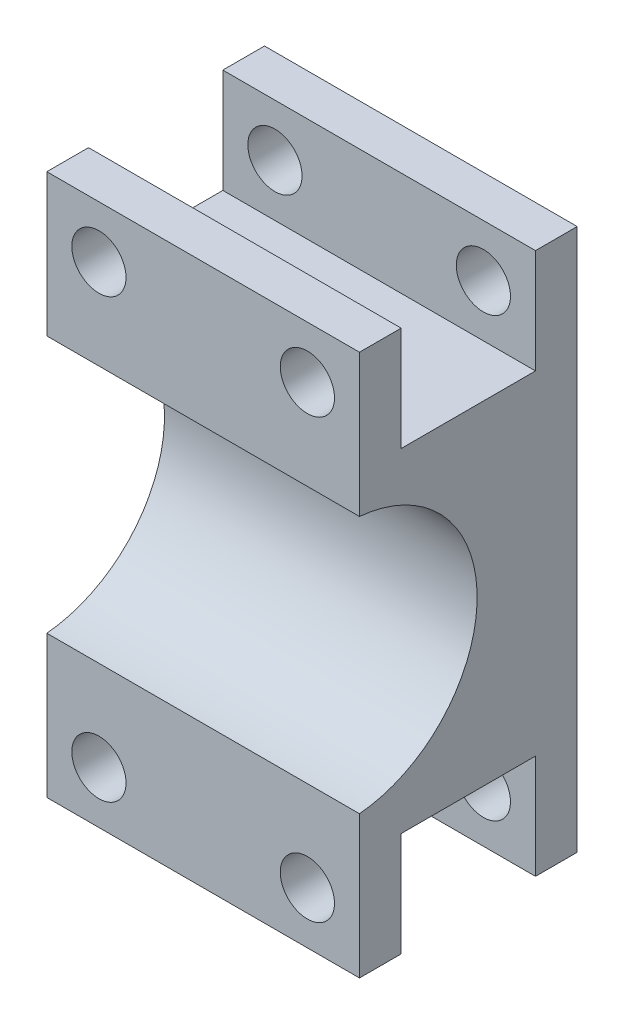
from build123d import *

# Parameters (mm, degrees)
SKETCH_1_W          = 30
SKETCH_1_H          = 32
EXTRUDE_1_DEPTH     = 7
EXTRUDE_2_DEPTH     = 30
SKETCH_3_R          = 2.6
EXTRUDE_3_DEPTH     = 4
SKETCH_4_W          = 30
SKETCH_4_H          = 4
EXTRUDE_5_DEPTH     = 10
SKETCH_5_W          = 30
SKETCH_5_H          = 4
EXTRUDE_6_DEPTH     = 10
CUT_EXTRUDE_START   = -10
SKETCH_6_R          = 2.6
CUT_EXTRUDE_1_DEPTH = 10


with BuildPart() as part:
    # Эскиз1 → Бобышка-Вытянуть1 (new body)
    with BuildSketch(Plane.XY):
        with Locations((15, 16)):
            Rectangle(SKETCH_1_W, SKETCH_1_H)
    extrude(amount=EXTRUDE_1_DEPTH)

    # Эскиз2 → Бобышка-Вытянуть2 (add)
    with BuildSketch(Plane.ZY):
        with BuildLine():
            Line((7, 32), (20.887570227, 32))
            Line((20.887570227, 32), (20.887570227, 28.35))
            ThreePointArc((20.887570227, 28.35), (9.6, 16), (20.887570227, 3.65))
            Line((20.887570227, 3.65), (20.887570227, 0))
            Line((20.887570227, 0), (7, 0))
            Line((7, 0), (7, 32))
        make_face()
    extrude(amount=-EXTRUDE_2_DEPTH)

    # Эскиз3 → Бобышка-Вытянуть3 (add)
    with BuildSketch(Plane(origin=(0, 0, 0), x_dir=(-1, 0, 0), z_dir=(0, 0, -1))):
        Polygon((-30, 16), (-30, -10), (0, -10), (0, 42), (-30, 42), align=None)
        with Locations((-25, 37)):
            Circle(SKETCH_3_R, mode=Mode.SUBTRACT)
        with Locations((-5, 37)):
            Circle(SKETCH_3_R, mode=Mode.SUBTRACT)
        with Locations((-5, -5)):
            Circle(SKETCH_3_R, mode=Mode.SUBTRACT)
        with Locations((-25, -5)):
            Circle(SKETCH_3_R, mode=Mode.SUBTRACT)
    extrude(amount=-EXTRUDE_3_DEPTH)

    # Эскиз4 → Бобышка-Вытянуть5 (add)
    with BuildSketch(Plane(origin=(0, 32, 0), x_dir=(1, 0, 0), z_dir=(0, 1, 0))):
        with Locations((15, -18.887570227)):
            Rectangle(SKETCH_4_W, SKETCH_4_H)
    extrude(amount=EXTRUDE_5_DEPTH)

    # Эскиз5 → Бобышка-Вытянуть6 (add)
    with BuildSketch(Plane.XZ):
        with Locations((15, 18.887570227)):
            Rectangle(SKETCH_5_W, SKETCH_5_H)
    extrude(amount=EXTRUDE_6_DEPTH)

    # Эскиз6 → Вырез-Вытянуть1 (cut)
    with BuildSketch(Plane.XY.offset(20.887570227).offset(CUT_EXTRUDE_START)):
        with Locations(Location((5, 37, 0), (0, 0, 180))):
            Circle(SKETCH_6_R)
        with Locations(Location((25, 37, 0), (0, 0, 180))):
            Circle(SKETCH_6_R)
        with Locations(Location((25, -5, 0), (0, 0, 180))):
            Circle(SKETCH_6_R)
        with Locations(Location((5, -5, 0), (0, 0, 180))):
            Circle(SKETCH_6_R)
    extrude(amount=CUT_EXTRUDE_1_DEPTH, mode=Mode.SUBTRACT)


solid = part.part
